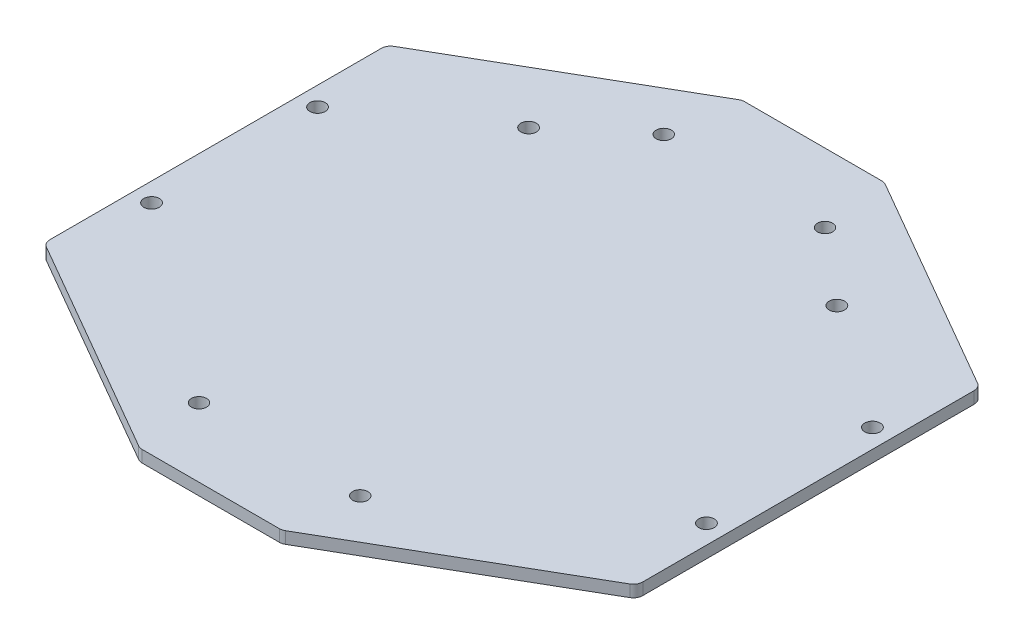
from build123d import *

# Parameters (mm, degrees)
BOSS_EXTRUDE1_DEPTH     = 2.5
SKETCH3_R               = 1.6
CUT_EXTRUDE1_DEPTH      = 10
SKETCH5_R               = 1.625
CUT_EXTRUDE2_DEPTH      = 10
CUT_EXTRUDE3_DEPTH      = 90.139403932
CUT_EXTRUDE3_DEPTH_BACK = 90.139403932
SKETCH6_R               = 1.625
FILLET1_R               = 2


with BuildPart() as part:
    # Sketch1 → Boss-Extrude1 (new body)
    with BuildSketch(Plane(origin=(0, 0, 0), x_dir=(1, 0, 0), z_dir=(0, 1, 0))):
        Polygon((-15, 63.508529611), (15, 63.508529611), (62.5, 36.084391824), (62.5, -36.084391824), (15, -63.508529611), (-15, -63.508529611), (-62.5, -36.084391824), (-62.5, 36.084391824), align=None)
    extrude(amount=BOSS_EXTRUDE1_DEPTH)

    # Sketch3 → Cut-Extrude1 (cut)
    with BuildSketch(Plane.XZ):
        with Locations(Location((17, 49, 0), (0, 0, 270))):
            Circle(SKETCH3_R)
        with Locations(Location((-17, 49, 0), (0, 0, 270))):
            Circle(SKETCH3_R)
        with Locations(Location((17, -49, 0), (0, 0, 90))):
            Circle(SKETCH3_R)
        with Locations(Location((-17, -49, 0), (0, 0, 90))):
            Circle(SKETCH3_R)
    extrude(amount=-CUT_EXTRUDE1_DEPTH, mode=Mode.SUBTRACT)

    # Sketch5 → Cut-Extrude2 (cut)
    with BuildSketch(Plane(origin=(0, 2.5, 0), x_dir=(1, 0, 0), z_dir=(0, 1, 0))):
        with Locations(Location((-32.5, 36, 0), (0, 0, 270))):
            Circle(SKETCH5_R)
        with Locations(Location((32.5, 36, 0), (0, 0, 270))):
            Circle(SKETCH5_R)
    extrude(amount=-CUT_EXTRUDE2_DEPTH, mode=Mode.SUBTRACT)

    # Sketch6 → Cut-Extrude3 (cut, two sides: drawn at the far end of the back side and taken through both)
    with BuildSketch(Plane(origin=(0, 2.5, 0), x_dir=(1, 0, 0), z_dir=(0, 1, 0)).offset(-CUT_EXTRUDE3_DEPTH_BACK)):
        with Locations(Location((-58.5, 17.5, 0), (0, 0, 270))):
            Circle(SKETCH6_R)
        with Locations(Location((-58.5, -17.5, 0), (0, 0, 270))):
            Circle(SKETCH6_R)
        with Locations(Location((58.5, -17.5, 0), (0, 0, 270))):
            Circle(SKETCH6_R)
        with Locations(Location((58.5, 17.5, 0), (0, 0, 270))):
            Circle(SKETCH6_R)
    extrude(amount=CUT_EXTRUDE3_DEPTH + CUT_EXTRUDE3_DEPTH_BACK, mode=Mode.SUBTRACT)

    # Fillet1
    fillet1_edges = [part.edges().sort_by_distance(p)[0] for p in [
        (-15, 1.25, -63.508529611),
        (15, 1.25, -63.508529611),
        (62.5, 1.25, -36.084391824),
        (62.5, 1.25, 36.084391824),
        (15, 1.25, 63.508529611),
        (-15, 1.25, 63.508529611),
        (-62.5, 1.25, 36.084391824),
        (-62.5, 1.25, -36.084391824),
    ]]
    fillet(fillet1_edges, radius=FILLET1_R)


solid = part.part
